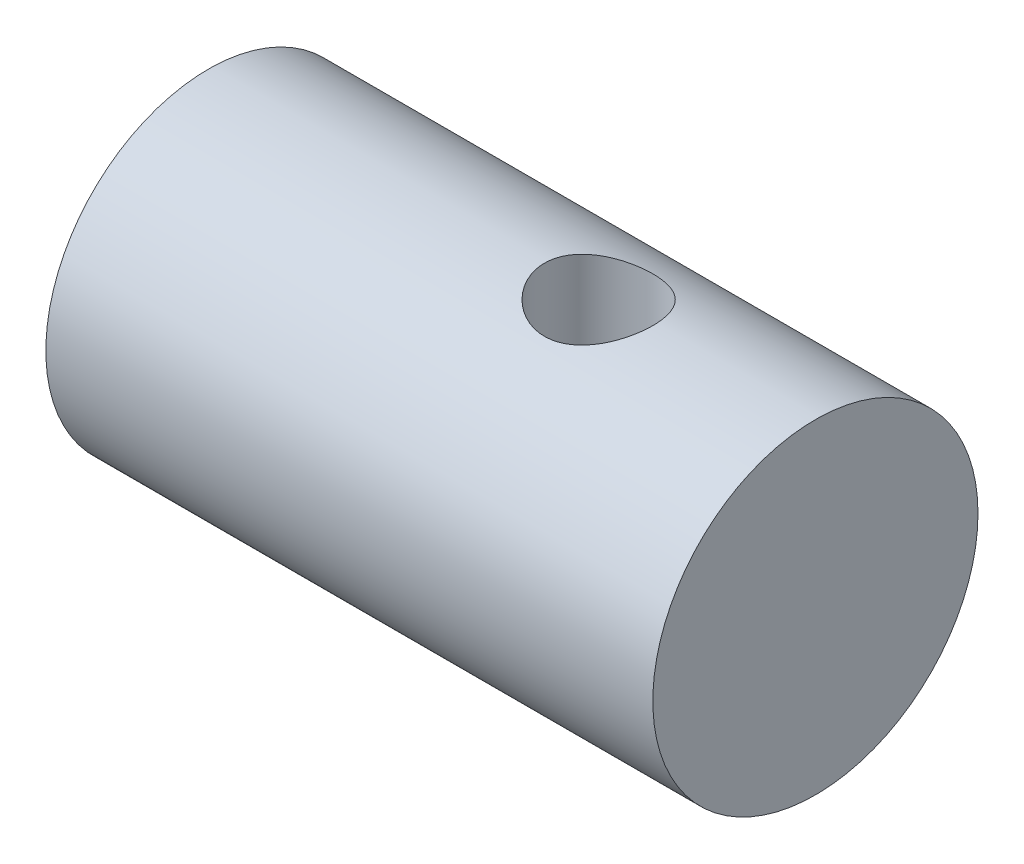
from build123d import *

# Parameters (mm, degrees)
FINISHED_SHAFT_ALLOCATION_SKETCH_R = 3
FINISHED_SHAFT_ALLOCATION_DEPTH    = 11.2
COUPLING_CROSS_PIN_BORE_SKETCH_R   = 1
COUPLING_CROSS_PIN_BORE_DEPTH      = 8


with BuildPart() as part:
    # Finished shaft allocation sketch → Finished shaft allocation (new body)
    with BuildSketch(Plane(origin=(-9.2, 0, 0), x_dir=(0, 0, -1), z_dir=(1, 0, 0))):
        with Locations((19.5, -29)):
            Circle(FINISHED_SHAFT_ALLOCATION_SKETCH_R)
    extrude(amount=FINISHED_SHAFT_ALLOCATION_DEPTH)

    # Coupling cross pin bore sketch → Coupling cross pin bore (cut)
    with BuildSketch(Plane(origin=(0, -33, 0), x_dir=(1, 0, 0), z_dir=(0, 1, 0))):
        with Locations(Location((-2, 19.5, 0), (0, 0, 90))):
            Circle(COUPLING_CROSS_PIN_BORE_SKETCH_R)
    extrude(amount=COUPLING_CROSS_PIN_BORE_DEPTH, mode=Mode.SUBTRACT)


solid = part.part
